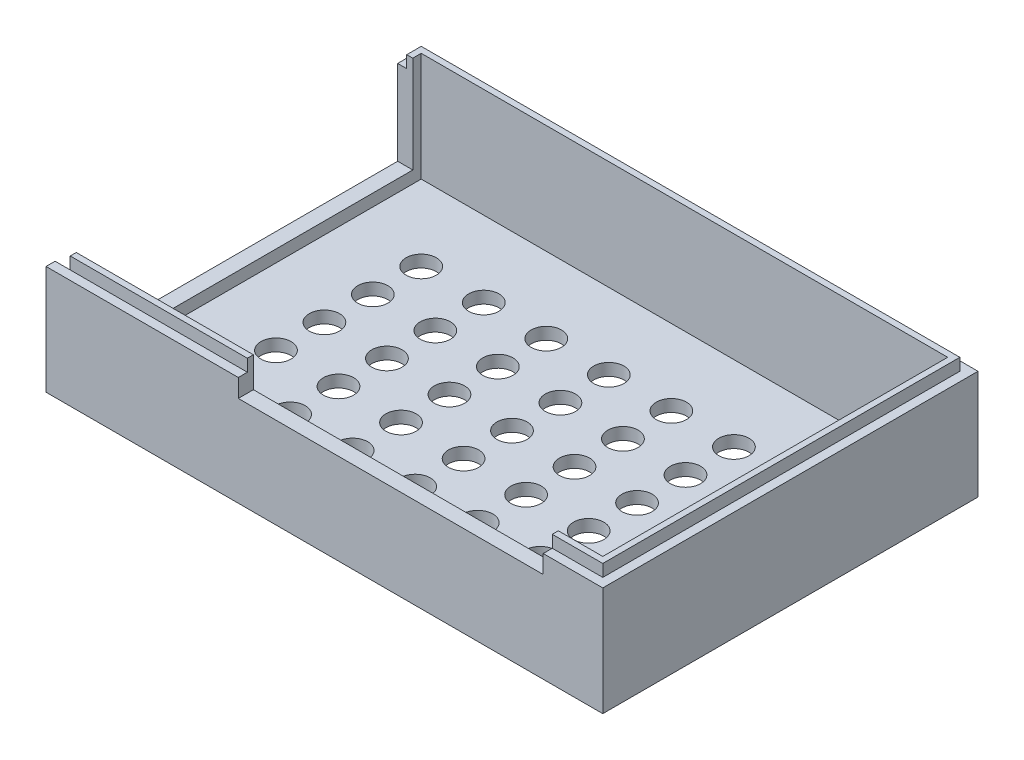
from build123d import *

# Parameters (mm, degrees)
CROQUIS1_W              = 92
CROQUIS1_H              = 62
SALIENTE_EXTRUIR1_DEPTH = 18
CROQUIS2_W              = 87
CROQUIS2_H              = 57
CORTAR_EXTRUIR1_DEPTH   = 16
CROQUIS3_W              = 89
CROQUIS3_H              = 59
CROQUIS3_W_2            = 87
CROQUIS3_H_2            = 57
SALIENTE_EXTRUIR2_DEPTH = 2
CROQUIS4_W              = 2.5
CROQUIS4_H              = 14.150072655
CROQUIS4_H_2            = 13.999979608
CROQUIS4_H_3            = 17.009234147
CORTAR_EXTRUIR2_DEPTH   = 16
CROQUIS5_W              = 9.965409089
CROQUIS5_H              = 2.5
CROQUIS5_W_2            = 7.304626576
CROQUIS5_W_3            = 7.420347284
CROQUIS5_W_4            = 5
CORTAR_EXTRUIR3_DEPTH   = 5
CROQUIS7_R              = 2.5
CORTAR_EXTRUIR4_DEPTH   = 2
CROQUIS8_W              = 50.384335714
CROQUIS8_H              = 5
CORTAR_EXTRUIR5_DEPTH   = 2.5
CROQUIS9_W              = 56.605701511
CROQUIS9_H              = 16
CORTAR_EXTRUIR6_DEPTH   = 2.5


with BuildPart() as part:
    # Croquis1 → Saliente-Extruir1 (new body)
    with BuildSketch(Plane(origin=(0, 0, 0), x_dir=(1, 0, 0), z_dir=(0, 1, 0))):
        Rectangle(CROQUIS1_W, CROQUIS1_H)
    extrude(amount=SALIENTE_EXTRUIR1_DEPTH)

    # Croquis2 → Cortar-Extruir1 (cut)
    with BuildSketch(Plane(origin=(0, 18, 0), x_dir=(1, 0, 0), z_dir=(0, 1, 0))):
        Rectangle(CROQUIS2_W, CROQUIS2_H)
    extrude(amount=-CORTAR_EXTRUIR1_DEPTH, mode=Mode.SUBTRACT)

    # Croquis3 → Saliente-Extruir2 (add)
    with BuildSketch(Plane(origin=(0, 18, 0), x_dir=(1, 0, 0), z_dir=(0, 1, 0))):
        Rectangle(CROQUIS3_W, CROQUIS3_H)
        Rectangle(CROQUIS3_W_2, CROQUIS3_H_2, mode=Mode.SUBTRACT)
    extrude(amount=SALIENTE_EXTRUIR2_DEPTH)

    # Croquis4 → Cortar-Extruir2 (cut)
    with BuildSketch(Plane(origin=(0, 20, 0), x_dir=(1, 0, 0), z_dir=(0, 1, 0))):
        with Locations((-44.75, -18.476544129)):
            Rectangle(CROQUIS4_W, CROQUIS4_H)
        with Locations((-44.75, -0.477589339)):
            Rectangle(CROQUIS4_W, CROQUIS4_H_2)
        with Locations((-44.75, 18.601084438)):
            Rectangle(CROQUIS4_W, CROQUIS4_H_3)
    extrude(amount=-CORTAR_EXTRUIR2_DEPTH, mode=Mode.SUBTRACT)

    # Croquis5 → Cortar-Extruir3 (cut)
    with BuildSketch(Plane(origin=(0, 20, 0), x_dir=(1, 0, 0), z_dir=(0, 1, 0))):
        with Locations((31.175863948, -29.75)):
            Rectangle(CROQUIS5_W, CROQUIS5_H)
        with Locations((16.189846179, -29.75)):
            Rectangle(CROQUIS5_W_2, CROQUIS5_H)
        with Locations((2.577919336, -29.75)):
            Rectangle(CROQUIS5_W_3, CROQUIS5_H)
        with Locations((-11.725767222, -29.75)):
            Rectangle(CROQUIS5_W_4, CROQUIS5_H)
    extrude(amount=-CORTAR_EXTRUIR3_DEPTH, mode=Mode.SUBTRACT)

    # Croquis7 → Cortar-Extruir4 (cut)
    with BuildSketch(Plane.XZ):
        with Locations(Location((31, -16, 0), (0, 0, 270))):
            Circle(CROQUIS7_R)
        with Locations(Location((20.666666667, -16, 0), (0, 0, 270))):
            Circle(CROQUIS7_R)
        with Locations(Location((10.333333333, -16, 0), (0, 0, 270))):
            Circle(CROQUIS7_R)
        with Locations(Location((0, -16, 0), (0, 0, 270))):
            Circle(CROQUIS7_R)
        with Locations(Location((-10.333333333, -16, 0), (0, 0, 270))):
            Circle(CROQUIS7_R)
        with Locations(Location((-20.666666667, -16, 0), (0, 0, 270))):
            Circle(CROQUIS7_R)
        with Locations(Location((-31, -16, 0), (0, 0, 270))):
            Circle(CROQUIS7_R)
        with Locations(Location((20.666666667, -8, 0), (0, 0, 270))):
            Circle(CROQUIS7_R)
        with Locations(Location((10.333333333, -8, 0), (0, 0, 270))):
            Circle(CROQUIS7_R)
        with Locations(Location((0, -8, 0), (0, 0, 270))):
            Circle(CROQUIS7_R)
        with Locations(Location((-10.333333333, -8, 0), (0, 0, 270))):
            Circle(CROQUIS7_R)
        with Locations(Location((-20.666666667, -8, 0), (0, 0, 270))):
            Circle(CROQUIS7_R)
        with Locations(Location((-31, -8, 0), (0, 0, 270))):
            Circle(CROQUIS7_R)
        with Locations(Location((20.666666667, 0, 0), (0, 0, 270))):
            Circle(CROQUIS7_R)
        with Locations(Location((10.333333333, 0, 0), (0, 0, 270))):
            Circle(CROQUIS7_R)
        with Locations(Location((0, 0, 0), (0, 0, 270))):
            Circle(CROQUIS7_R)
        with Locations(Location((-10.333333333, 0, 0), (0, 0, 270))):
            Circle(CROQUIS7_R)
        with Locations(Location((-20.666666667, 0, 0), (0, 0, 270))):
            Circle(CROQUIS7_R)
        with Locations(Location((-31, 0, 0), (0, 0, 270))):
            Circle(CROQUIS7_R)
        with Locations(Location((20.666666667, 8, 0), (0, 0, 270))):
            Circle(CROQUIS7_R)
        with Locations(Location((10.333333333, 8, 0), (0, 0, 270))):
            Circle(CROQUIS7_R)
        with Locations(Location((0, 8, 0), (0, 0, 270))):
            Circle(CROQUIS7_R)
        with Locations(Location((-10.333333333, 8, 0), (0, 0, 270))):
            Circle(CROQUIS7_R)
        with Locations(Location((-20.666666667, 8, 0), (0, 0, 270))):
            Circle(CROQUIS7_R)
        with Locations(Location((-31, 8, 0), (0, 0, 270))):
            Circle(CROQUIS7_R)
        with Locations(Location((20.666666667, 16, 0), (0, 0, 270))):
            Circle(CROQUIS7_R)
        with Locations(Location((10.333333333, 16, 0), (0, 0, 270))):
            Circle(CROQUIS7_R)
        with Locations(Location((0, 16, 0), (0, 0, 270))):
            Circle(CROQUIS7_R)
        with Locations(Location((-10.333333333, 16, 0), (0, 0, 270))):
            Circle(CROQUIS7_R)
        with Locations(Location((-20.666666667, 16, 0), (0, 0, 270))):
            Circle(CROQUIS7_R)
        with Locations(Location((-31, 16, 0), (0, 0, 270))):
            Circle(CROQUIS7_R)
        with Locations(Location((31, -8, 0), (0, 0, 270))):
            Circle(CROQUIS7_R)
        with Locations(Location((31, 0, 0), (0, 0, 270))):
            Circle(CROQUIS7_R)
        with Locations(Location((31, 8, 0), (0, 0, 270))):
            Circle(CROQUIS7_R)
        with Locations(Location((31, 16, 0), (0, 0, 270))):
            Circle(CROQUIS7_R)
    extrude(amount=-CORTAR_EXTRUIR4_DEPTH, mode=Mode.SUBTRACT)

    # Croquis8 → Cortar-Extruir5 (cut)
    with BuildSketch(Plane.XY.offset(31)):
        with Locations((10.966400635, 17.5)):
            Rectangle(CROQUIS8_W, CROQUIS8_H)
    extrude(amount=-CORTAR_EXTRUIR5_DEPTH, mode=Mode.SUBTRACT)

    # Croquis9 → Cortar-Extruir6 (cut)
    with BuildSketch(Plane.ZY.offset(46)):
        with Locations((1.197149245, 12)):
            Rectangle(CROQUIS9_W, CROQUIS9_H)
    extrude(amount=-CORTAR_EXTRUIR6_DEPTH, mode=Mode.SUBTRACT)


solid = part.part
